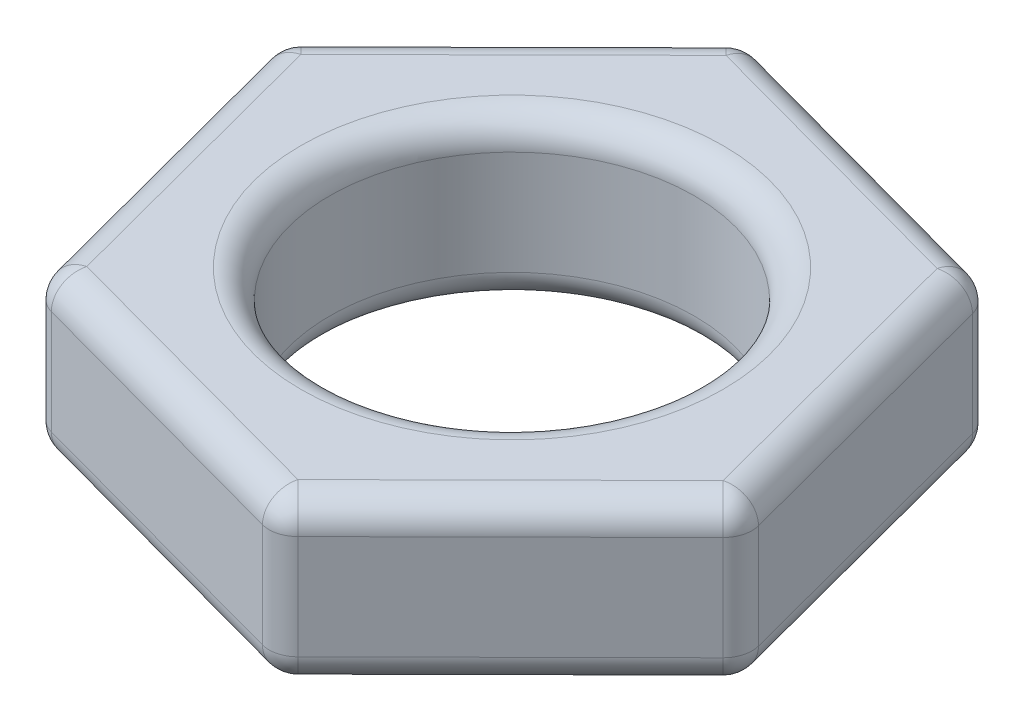
from build123d import *

# Parameters (mm, degrees)
SKETCH1_R           = 4
BOSS_EXTRUDE1_DEPTH = 3.556
FILLET1_R           = 0.635
FILLET2_R           = 0.635


with BuildPart() as part:
    # Sketch1 → Boss-Extrude1 (new body)
    with BuildSketch(Plane(origin=(0, 0, 0), x_dir=(1, 0, 0), z_dir=(0, 1, 0))):
        Polygon((5.205006366, 5.164420787), (-1.870016414, 7.089878133), (-7.07502278, 1.925457346), (-5.205006366, -5.164420787), (1.870016414, -7.089878133), (7.07502278, -1.925457346), align=None)
        with Locations(Location((0, 0, 0), (0, 0, 270))):
            Circle(SKETCH1_R, mode=Mode.SUBTRACT)
    extrude(amount=BOSS_EXTRUDE1_DEPTH)

    # Fillet1
    fillet1_edges = [part.edges().sort_by_distance(p)[0] for p in [
        (0, 0, -4),
        (0, 3.556, -4),
    ]]
    fillet(fillet1_edges, radius=FILLET1_R)

    # Fillet2
    fillet2_edges = [part.edges().sort_by_distance(p)[0] for p in [
        (-4.472519597, 3.556, -4.50766774),
        (7.07502278, 1.778, 1.925457346),
        (1.870016414, 1.778, 7.089878133),
        (-5.205006366, 1.778, 5.164420787),
        (-7.07502278, 1.778, -1.925457346),
        (-1.870016414, 1.778, -7.089878133),
        (5.205006366, 1.778, -5.164420787),
        (-6.140014573, 3.556, 1.61948172),
        (-1.667494976, 3.556, 6.12714946),
        (4.472519597, 3.556, 4.50766774),
        (6.140014573, 3.556, -1.61948172),
        (4.472519597, 0, 4.50766774),
        (-1.667494976, 0, 6.12714946),
        (-6.140014573, 0, 1.61948172),
        (1.667494976, 3.556, -6.12714946),
        (-4.472519597, 0, -4.50766774),
        (1.667494976, 0, -6.12714946),
        (6.140014573, 0, -1.61948172),
    ]]
    fillet(fillet2_edges, radius=FILLET2_R)


solid = part.part
